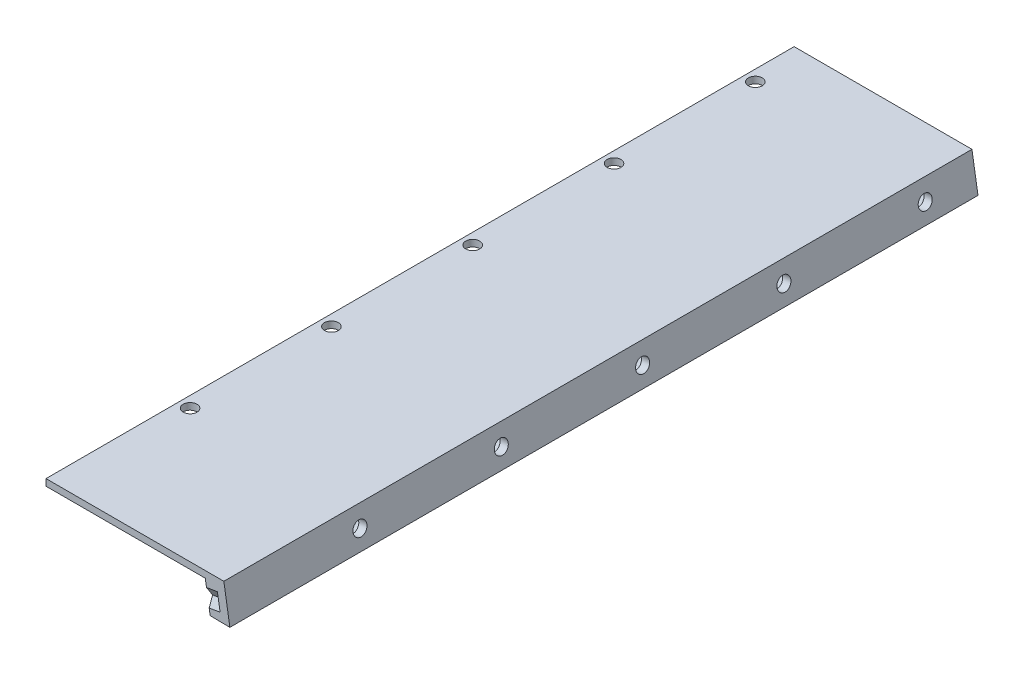
from build123d import *

# Parameters (mm, degrees)
BOSS_EXTRUDE1_DEPTH = 171
SKETCH2_R           = 1.25
CUT_EXTRUDE1_DEPTH  = 50
SKETCH3_R           = 1.25
CUT_EXTRUDE2_DEPTH  = 50
CUT_EXTRUDE3_DEPTH  = 2
LPATTERN1_COUNT     = 7
LPATTERN1_PITCH     = 25.5
SKETCH5_W           = 58.422821226
SKETCH5_H           = 32.27704233
CUT_EXTRUDE4_DEPTH  = 36


with BuildPart() as part:
    # Sketch1 → Boss-Extrude1 (new body)
    with BuildSketch(Plane.XY):
        Polygon((0, 0), (32.09, 0), (33.178500502, -6.66165645), (29.624787969, -6.61699683), (28.739662203, -1.2), (0, -1.2), align=None)
    extrude(amount=BOSS_EXTRUDE1_DEPTH)

    # Sketch2 → Cut-Extrude1 (cut)
    with BuildSketch(Plane(origin=(0, 0, 0), x_dir=(1, 0, 0), z_dir=(0, 1, 0))):
        with Locations(Location((2, -9, 0), (0, 0, 270))):
            Circle(SKETCH2_R)
    cut_extrude1 = extrude(amount=-CUT_EXTRUDE1_DEPTH, mode=Mode.SUBTRACT)

    # Sketch3 → Cut-Extrude2 (cut)
    with BuildSketch(Plane(origin=(31.255513263, 5.107084422, 0), x_dir=(0, 0, -1), z_dir=(0.9869120666582158, 0.16125933363501674, 0))):
        with Locations(Location((-9, -8.674812016, 0), (0, 0, 90))):
            Circle(SKETCH3_R)
    cut_extrude2 = extrude(amount=-CUT_EXTRUDE2_DEPTH, mode=Mode.SUBTRACT)

    # Sketch4 → Cut-Extrude3 (cut)
    with BuildSketch(Plane(origin=(27.801321029, 4.542676754, 0), x_dir=(0, 0, 1), z_dir=(-0.9869120666582157, -0.1612593336350174, 0))):
        Polygon((7.816431948, -6.624812016), (6.632863896, -8.674812016), (7.816431948, -10.724812016), (10.183568052, -10.724812016), (11.367136104, -8.674812016), (10.183568052, -6.624812016), align=None)
    cut_extrude3 = extrude(amount=-CUT_EXTRUDE3_DEPTH, mode=Mode.SUBTRACT)

    # LPattern1: Cut-Extrude1, Cut-Extrude2, Cut-Extrude3 ×7
    with Locations(*[(0, 0, i * LPATTERN1_PITCH) for i in range(1, LPATTERN1_COUNT)]):
        add(cut_extrude1, mode=Mode.SUBTRACT)
        add(cut_extrude2, mode=Mode.SUBTRACT)
        add(cut_extrude3, mode=Mode.SUBTRACT)

    # Sketch5 → Cut-Extrude4 (cut)
    with BuildSketch(Plane.XY.offset(171)):
        with Locations((17.719091417, -1.694811413)):
            Rectangle(SKETCH5_W, SKETCH5_H)
    extrude(amount=-CUT_EXTRUDE4_DEPTH, mode=Mode.SUBTRACT)


solid = part.part
